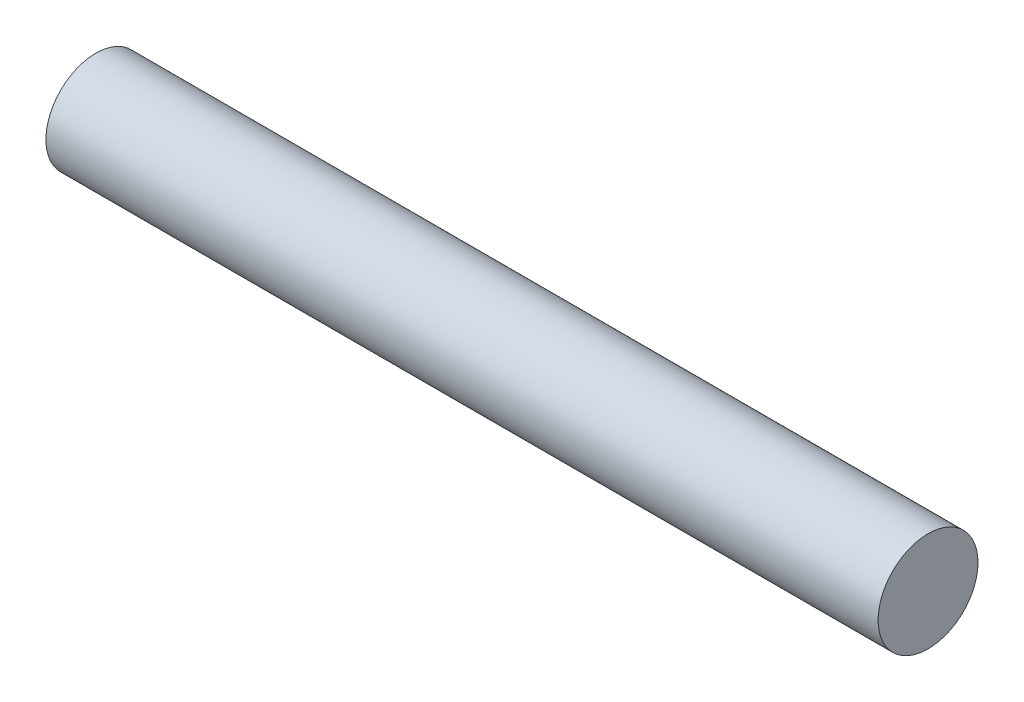
from build123d import *

# Parameters (mm, degrees)
SKETCH1_R           = 0.75
BOSS_EXTRUDE1_DEPTH = 6.25


with BuildPart() as part:
    # Sketch1 → Boss-Extrude1 (new, symmetric)
    with BuildSketch(Plane(origin=(0, 0, 0), x_dir=(0, 0, -1), z_dir=(1, 0, 0))):
        Circle(SKETCH1_R)
    extrude(amount=BOSS_EXTRUDE1_DEPTH, both=True)


solid = part.part
